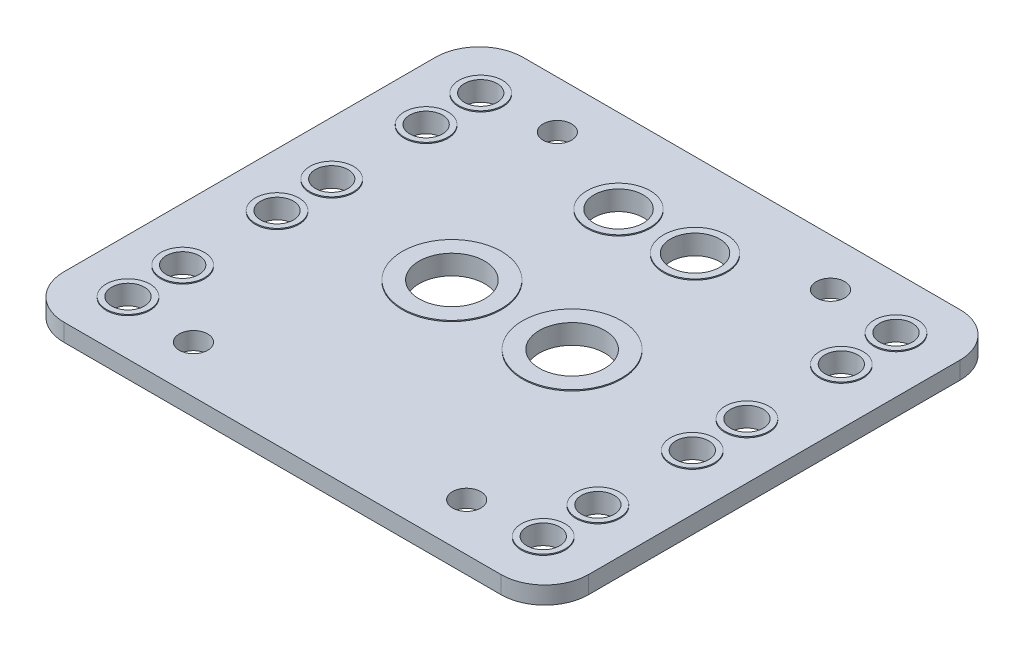
from build123d import *

# Parameters (mm, degrees)
SALIENTE_EXTRUIR1_DEPTH    = 0.8
CORTAR_EXTRUIR1_DEPTH      = 32.930549635
CORTAR_EXTRUIR1_DEPTH_BACK = 32.930549635
CROQUIS2_R                 = 1.3
CROQUIS3_R                 = 3
CORTAR_EXTRUIR2_DEPTH      = 32.930549635
CROQUIS5_R                 = 4.533685243
CROQUIS5_R_2               = 3
SALIENTE_EXTRUIR2_DEPTH    = 0.9
CROQUIS6_R                 = 2.25
CROQUIS6_R_2               = 1.5
CORTAR_EXTRUIR3_DEPTH      = 32.935716682
CROQUIS7_R                 = 2
CROQUIS7_R_2               = 1.5
CROQUIS7_R_3               = 2.894896359
CROQUIS7_R_4               = 2.25
SALIENTE_EXTRUIR3_DEPTH    = 0.9


with BuildPart() as part:
    # Croquis1 → Saliente-Extruir1 (new, symmetric)
    with BuildSketch(Plane(origin=(0, 0, 0), x_dir=(1, 0, 0), z_dir=(0, 1, 0))):
        with BuildLine():
            Line((-20, 21), (20, 21))
            ThreePointArc((20, 21), (22.828427125, 19.828427125), (24, 17))
            Line((24, 17), (24, -17))
            ThreePointArc((24, -17), (22.828427125, -19.828427125), (20, -21))
            Line((20, -21), (-20, -21))
            ThreePointArc((-20, -21), (-22.828427125, -19.828427125), (-24, -17))
            Line((-24, -17), (-24, 17))
            ThreePointArc((-24, 17), (-22.828427125, 19.828427125), (-20, 21))
        make_face()
    extrude(amount=SALIENTE_EXTRUIR1_DEPTH, both=True)

    # Croquis2 → Cortar-Extruir1 (cut, two sides: drawn at the far end of the back side and taken through both)
    with BuildSketch(Plane(origin=(0, 0.8, 0), x_dir=(1, 0, 0), z_dir=(0, 1, 0)).offset(-CORTAR_EXTRUIR1_DEPTH_BACK)):
        with Locations(Location((-12.5, 16.65, 0), (0, 0, 270))):
            Circle(CROQUIS2_R)
        with Locations(Location((12.5, 16.65, 0), (0, 0, 270))):
            Circle(CROQUIS2_R)
        with Locations(Location((12.5, -16.65, 0), (0, 0, 270))):
            Circle(CROQUIS2_R)
        with Locations(Location((-12.5, -16.65, 0), (0, 0, 270))):
            Circle(CROQUIS2_R)
    extrude(amount=CORTAR_EXTRUIR1_DEPTH + CORTAR_EXTRUIR1_DEPTH_BACK, mode=Mode.SUBTRACT)

    # Croquis3 → Cortar-Extruir2 (cut, through all)
    with BuildSketch(Plane(origin=(0, 0.8, 0), x_dir=(1, 0, 0), z_dir=(0, 1, 0))):
        with Locations(Location((-5.5, 0, 0), (0, 0, 270))):
            Circle(CROQUIS3_R)
        with Locations(Location((5.5, 0, 0), (0, 0, 270))):
            Circle(CROQUIS3_R)
    extrude(amount=-CORTAR_EXTRUIR2_DEPTH, mode=Mode.SUBTRACT)

    # Croquis5 → Saliente-Extruir2 (add, symmetric)
    # profile 1 of 2: a face of its own
    with BuildSketch(Plane(origin=(0, 0, 0), x_dir=(1, 0, 0), z_dir=(0, 1, 0))):
        with Locations(Location((-5.5, 0, 0), (0, 0, 90))):
            Circle(CROQUIS5_R)
        with Locations(Location((-5.5, 0, 0), (0, 0, 270))):
            Circle(CROQUIS5_R_2, mode=Mode.SUBTRACT)
    # profile 2 of 2: a face of its own
    with BuildSketch(Plane(origin=(0, 0, 0), x_dir=(1, 0, 0), z_dir=(0, 1, 0))):
        with Locations(Location((5.5, 0, 0), (0, 0, 90))):
            Circle(CROQUIS5_R)
        with Locations(Location((5.5, 0, 0), (0, 0, 270))):
            Circle(CROQUIS5_R_2, mode=Mode.SUBTRACT)
    extrude(amount=SALIENTE_EXTRUIR2_DEPTH, both=True)

    # Croquis6 → Cortar-Extruir3 (cut, through all)
    with BuildSketch(Plane(origin=(0, 0.8, 0), x_dir=(1, 0, 0), z_dir=(0, 1, 0))):
        with Locations(Location((-3.5, 13.25, 0), (0, 0, 270))):
            Circle(CROQUIS6_R)
        with Locations(Location((3.5, 13.25, 0), (0, 0, 270))):
            Circle(CROQUIS6_R)
        with Locations(Location((-19, 2.5, 0), (0, 0, 270))):
            Circle(CROQUIS6_R_2)
        with Locations(Location((-19, -2.5, 0), (0, 0, 270))):
            Circle(CROQUIS6_R_2)
        with Locations(Location((-19, 11.14, 0), (0, 0, 270))):
            Circle(CROQUIS6_R_2)
        with Locations(Location((-19, 16.14, 0), (0, 0, 270))):
            Circle(CROQUIS6_R_2)
        with Locations(Location((-19, -11.14, 0), (0, 0, 270))):
            Circle(CROQUIS6_R_2)
        with Locations(Location((-19, -16.14, 0), (0, 0, 270))):
            Circle(CROQUIS6_R_2)
        with Locations(Location((19, -16.14, 0), (0, 0, 90))):
            Circle(CROQUIS6_R_2)
        with Locations(Location((19, -11.14, 0), (0, 0, 90))):
            Circle(CROQUIS6_R_2)
        with Locations(Location((19, 16.14, 0), (0, 0, 90))):
            Circle(CROQUIS6_R_2)
        with Locations(Location((19, 11.14, 0), (0, 0, 90))):
            Circle(CROQUIS6_R_2)
        with Locations(Location((19, -2.5, 0), (0, 0, 90))):
            Circle(CROQUIS6_R_2)
        with Locations(Location((19, 2.5, 0), (0, 0, 90))):
            Circle(CROQUIS6_R_2)
    extrude(amount=-CORTAR_EXTRUIR3_DEPTH, mode=Mode.SUBTRACT)

    # Croquis7 → Saliente-Extruir3 (add, symmetric)
    # profile 1 of 14: a face of its own
    with BuildSketch(Plane(origin=(0, 0, 0), x_dir=(1, 0, 0), z_dir=(0, 1, 0))):
        with Locations(Location((-19, 16.14, 0), (0, 0, 90))):
            Circle(CROQUIS7_R)
        with Locations(Location((-19, 16.14, 0), (0, 0, 270))):
            Circle(CROQUIS7_R_2, mode=Mode.SUBTRACT)
    # profile 2 of 14: a face of its own
    with BuildSketch(Plane(origin=(0, 0, 0), x_dir=(1, 0, 0), z_dir=(0, 1, 0))):
        with Locations(Location((-19, 11.14, 0), (0, 0, 90))):
            Circle(CROQUIS7_R)
        with Locations(Location((-19, 11.14, 0), (0, 0, 270))):
            Circle(CROQUIS7_R_2, mode=Mode.SUBTRACT)
    # profile 3 of 14: a face of its own
    with BuildSketch(Plane(origin=(0, 0, 0), x_dir=(1, 0, 0), z_dir=(0, 1, 0))):
        with Locations(Location((-19, 2.5, 0), (0, 0, 90))):
            Circle(CROQUIS7_R)
        with Locations(Location((-19, 2.5, 0), (0, 0, 270))):
            Circle(CROQUIS7_R_2, mode=Mode.SUBTRACT)
    # profile 4 of 14: a face of its own
    with BuildSketch(Plane(origin=(0, 0, 0), x_dir=(1, 0, 0), z_dir=(0, 1, 0))):
        with Locations(Location((-19, -2.5, 0), (0, 0, 90))):
            Circle(CROQUIS7_R)
        with Locations(Location((-19, -2.5, 0), (0, 0, 270))):
            Circle(CROQUIS7_R_2, mode=Mode.SUBTRACT)
    # profile 5 of 14: a face of its own
    with BuildSketch(Plane(origin=(0, 0, 0), x_dir=(1, 0, 0), z_dir=(0, 1, 0))):
        with Locations(Location((-19, -16.14, 0), (0, 0, 90))):
            Circle(CROQUIS7_R)
        with Locations(Location((-19, -16.14, 0), (0, 0, 270))):
            Circle(CROQUIS7_R_2, mode=Mode.SUBTRACT)
    # profile 6 of 14: a face of its own
    with BuildSketch(Plane(origin=(0, 0, 0), x_dir=(1, 0, 0), z_dir=(0, 1, 0))):
        with Locations(Location((-19, -11.14, 0), (0, 0, 90))):
            Circle(CROQUIS7_R)
        with Locations(Location((-19, -11.14, 0), (0, 0, 270))):
            Circle(CROQUIS7_R_2, mode=Mode.SUBTRACT)
    # profile 7 of 14: a face of its own
    with BuildSketch(Plane(origin=(0, 0, 0), x_dir=(1, 0, 0), z_dir=(0, 1, 0))):
        with Locations(Location((-3.5, 13.25, 0), (0, 0, 90))):
            Circle(CROQUIS7_R_3)
        with Locations(Location((-3.5, 13.25, 0), (0, 0, 270))):
            Circle(CROQUIS7_R_4, mode=Mode.SUBTRACT)
    # profile 8 of 14: a face of its own
    with BuildSketch(Plane(origin=(0, 0, 0), x_dir=(1, 0, 0), z_dir=(0, 1, 0))):
        with Locations(Location((3.5, 13.25, 0), (0, 0, 90))):
            Circle(CROQUIS7_R_3)
        with Locations(Location((3.5, 13.25, 0), (0, 0, 90))):
            Circle(CROQUIS7_R_4, mode=Mode.SUBTRACT)
    # profile 9 of 14: a face of its own
    with BuildSketch(Plane(origin=(0, 0, 0), x_dir=(1, 0, 0), z_dir=(0, 1, 0))):
        with Locations(Location((19, -11.14, 0), (0, 0, 90))):
            Circle(CROQUIS7_R)
        with Locations(Location((19, -11.14, 0), (0, 0, 90))):
            Circle(CROQUIS7_R_2, mode=Mode.SUBTRACT)
    # profile 10 of 14: a face of its own
    with BuildSketch(Plane(origin=(0, 0, 0), x_dir=(1, 0, 0), z_dir=(0, 1, 0))):
        with Locations(Location((19, -16.14, 0), (0, 0, 90))):
            Circle(CROQUIS7_R)
        with Locations(Location((19, -16.14, 0), (0, 0, 90))):
            Circle(CROQUIS7_R_2, mode=Mode.SUBTRACT)
    # profile 11 of 14: a face of its own
    with BuildSketch(Plane(origin=(0, 0, 0), x_dir=(1, 0, 0), z_dir=(0, 1, 0))):
        with Locations(Location((19, -2.5, 0), (0, 0, 90))):
            Circle(CROQUIS7_R)
        with Locations(Location((19, -2.5, 0), (0, 0, 90))):
            Circle(CROQUIS7_R_2, mode=Mode.SUBTRACT)
    # profile 12 of 14: a face of its own
    with BuildSketch(Plane(origin=(0, 0, 0), x_dir=(1, 0, 0), z_dir=(0, 1, 0))):
        with Locations(Location((19, 2.5, 0), (0, 0, 90))):
            Circle(CROQUIS7_R)
        with Locations(Location((19, 2.5, 0), (0, 0, 90))):
            Circle(CROQUIS7_R_2, mode=Mode.SUBTRACT)
    # profile 13 of 14: a face of its own
    with BuildSketch(Plane(origin=(0, 0, 0), x_dir=(1, 0, 0), z_dir=(0, 1, 0))):
        with Locations(Location((19, 11.14, 0), (0, 0, 90))):
            Circle(CROQUIS7_R)
        with Locations(Location((19, 11.14, 0), (0, 0, 90))):
            Circle(CROQUIS7_R_2, mode=Mode.SUBTRACT)
    # profile 14 of 14: a face of its own
    with BuildSketch(Plane(origin=(0, 0, 0), x_dir=(1, 0, 0), z_dir=(0, 1, 0))):
        with Locations(Location((19, 16.14, 0), (0, 0, 90))):
            Circle(CROQUIS7_R)
        with Locations(Location((19, 16.14, 0), (0, 0, 90))):
            Circle(CROQUIS7_R_2, mode=Mode.SUBTRACT)
    extrude(amount=SALIENTE_EXTRUIR3_DEPTH, both=True)


solid = part.part
